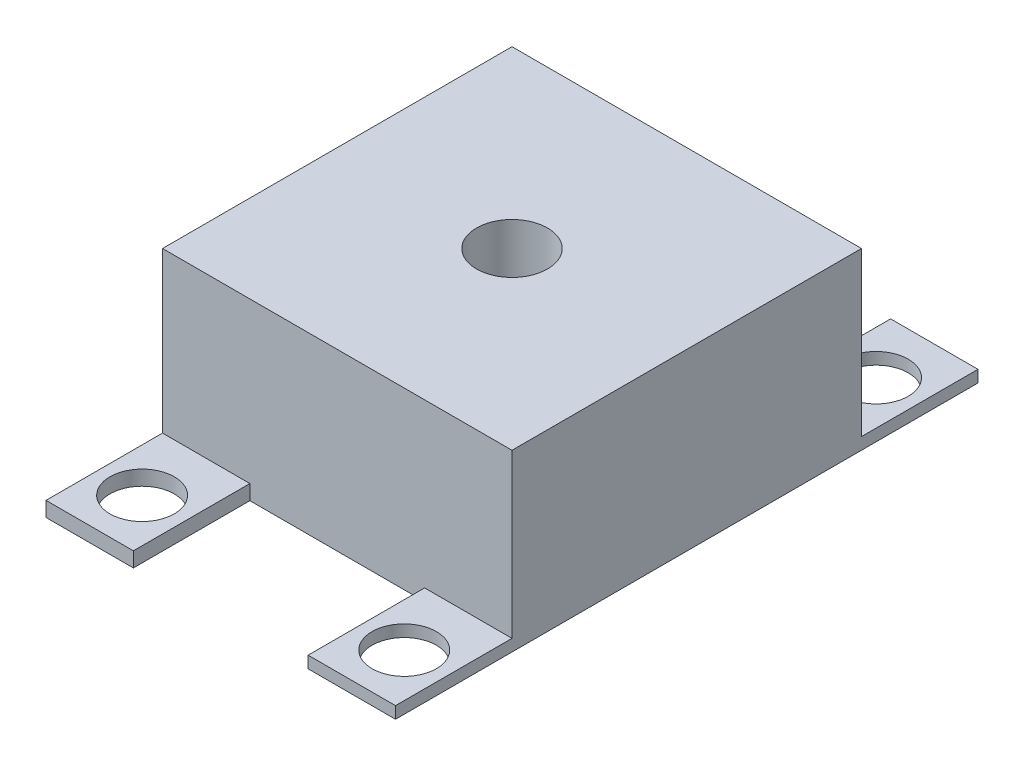
from build123d import *

# Parameters (mm, degrees)
SKETCH2_W                = 30
SKETCH2_H                = 30
BOSS_EXTRUDE1_DEPTH      = 10
SKETCH3_W                = 30
SKETCH3_H                = 30
SKETCH3_W_2              = 25
SKETCH3_H_2              = 25
BOSS_EXTRUDE2_DEPTH      = 15
SKETCH4_W                = 30
SKETCH4_H                = 30
BOSS_EXTRUDE3_DEPTH      = 15
CUT_EXTRUDE1_START       = -40
SKETCH5_R                = 3.05
CUT_EXTRUDE1_DEPTH       = 40
BOSS_EXTRUDE4_DEPTH      = 10
BOSS_EXTRUDE4_DEPTH_BACK = 40
SKETCH6_W                = 7.5
SKETCH6_H                = 1.017843133
SKETCH6_H_2              = 1.2761833
SKETCH7_R                = 2.76
CUT_EXTRUDE2_DEPTH       = 10


with BuildPart() as part:
    # Sketch2 → Boss-Extrude1 (new body)
    with BuildSketch(Plane(origin=(0, 0, 0), x_dir=(1, 0, 0), z_dir=(0, 1, 0))):
        Rectangle(SKETCH2_W, SKETCH2_H)
    extrude(amount=BOSS_EXTRUDE1_DEPTH)


with BuildPart() as body_2:
    # Sketch3 → Boss-Extrude2 (new body)
    with BuildSketch(Plane(origin=(0, 10, 0), x_dir=(1, 0, 0), z_dir=(0, 1, 0))):
        Rectangle(SKETCH3_W, SKETCH3_H)
        Rectangle(SKETCH3_W_2, SKETCH3_H_2, mode=Mode.SUBTRACT)
    extrude(amount=BOSS_EXTRUDE2_DEPTH)


with BuildPart() as body_3:
    # Sketch4 → Boss-Extrude3 (new body)
    with BuildSketch(Plane(origin=(0, 25, 0), x_dir=(1, 0, 0), z_dir=(0, 1, 0))):
        Rectangle(SKETCH4_W, SKETCH4_H)
    extrude(amount=BOSS_EXTRUDE3_DEPTH)


with BuildPart() as cut_extrude1_tool:
    # Sketch5 → Cut-Extrude1 (new body)
    with BuildSketch(Plane(origin=(0, 40, 0), x_dir=(1, 0, 0), z_dir=(0, 1, 0)).offset(CUT_EXTRUDE1_START)):
        with Locations(Location((0, 0, 0), (0, 0, 270))):
            Circle(SKETCH5_R)
    extrude(amount=CUT_EXTRUDE1_DEPTH)


with BuildPart() as part_1:
    add(part.part)

    # Cut-Extrude1: cut by cut_extrude1_tool
    add(cut_extrude1_tool.part, mode=Mode.SUBTRACT)


with BuildPart() as body_3_1:
    add(body_3.part)

    # Cut-Extrude1: cut by cut_extrude1_tool
    add(cut_extrude1_tool.part, mode=Mode.SUBTRACT)

    # Sketch6 → Boss-Extrude4 (add, two sides: drawn at the far end of the back side and taken through both)
    with BuildSketch(Plane(origin=(0, 0, -15), x_dir=(-1, 0, 0), z_dir=(0, 0, -1)).offset(-BOSS_EXTRUDE4_DEPTH_BACK)):
        with Locations((-11.25, 25.508921566)):
            Rectangle(SKETCH6_W, SKETCH6_H)
        with Locations((11.25, 25.63809165)):
            Rectangle(SKETCH6_W, SKETCH6_H_2)
    extrude(amount=BOSS_EXTRUDE4_DEPTH + BOSS_EXTRUDE4_DEPTH_BACK)

    # Sketch7 → Cut-Extrude2 (cut)
    with BuildSketch(Plane(origin=(0, 26.2761833, 0), x_dir=(1, 0, 0), z_dir=(0, 1, 0))):
        with Locations(Location((-11.25, 20, 0), (0, 0, 270))):
            Circle(SKETCH7_R)
        with Locations(Location((11.25, 20, 0), (0, 0, 270))):
            Circle(SKETCH7_R)
        with Locations(Location((11.25, -20.5, 0), (0, 0, 270))):
            Circle(SKETCH7_R)
        with Locations(Location((-11.25, -20.5, 0), (0, 0, 270))):
            Circle(SKETCH7_R)
    extrude(amount=-CUT_EXTRUDE2_DEPTH, mode=Mode.SUBTRACT)


solid = body_3_1.part
